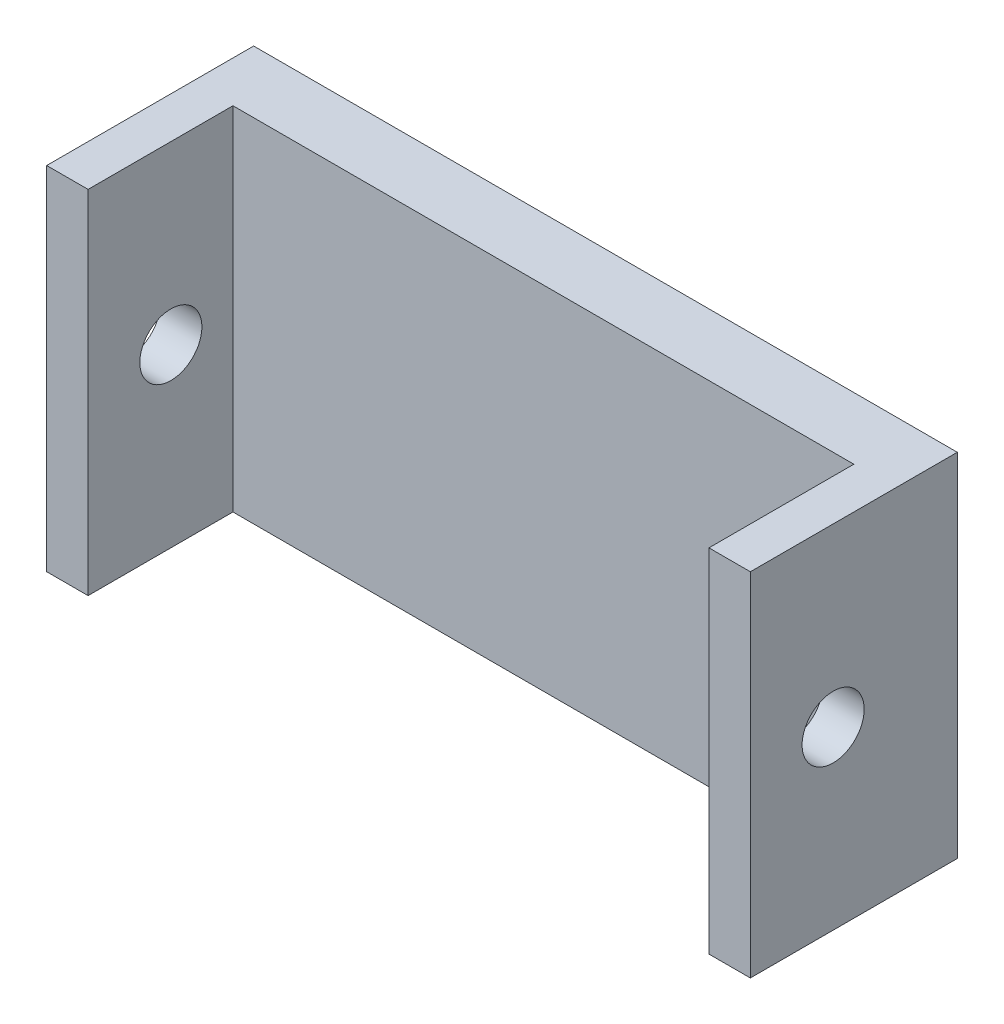
from build123d import *

# Parameters (mm, degrees)
ESQUISSE1_W                  = 30
ESQUISSE1_H                  = 17
BOSS_EXTRU_1_DEPTH           = 3
ESQUISSE2_W                  = 2
ESQUISSE2_H                  = 17
BOSS_EXTRU_2_DEPTH           = 10
ENL_V_MAT_EXTRU_1_DEPTH      = 22.476731595
ENL_V_MAT_EXTRU_1_DEPTH_BACK = 22.476731595
ESQUISSE3_R                  = 1.5
ESQUISSE4_W                  = 1.346153846
ESQUISSE4_H                  = 0.358974359
ENL_V_MAT_EXTRU_2_DEPTH      = 1


with BuildPart() as part:
    # Esquisse1 → Boss.-Extru.1 (new body)
    with BuildSketch(Plane.XY):
        Rectangle(ESQUISSE1_W, ESQUISSE1_H)
    extrude(amount=BOSS_EXTRU_1_DEPTH)

    # Esquisse2 → Boss.-Extru.2 (add)
    with BuildSketch(Plane.XY):
        with Locations((-16, 0)):
            Rectangle(ESQUISSE2_W, ESQUISSE2_H)
        with Locations((16, 0)):
            Rectangle(ESQUISSE2_W, ESQUISSE2_H)
    extrude(amount=BOSS_EXTRU_2_DEPTH)

    # Esquisse3 → Enlèv. mat.-Extru.1 (cut, two sides: drawn at the far end of the back side and taken through both)
    with BuildSketch(Plane(origin=(0, 0, 0), x_dir=(0, 0, -1), z_dir=(1, 0, 0)).offset(-ENL_V_MAT_EXTRU_1_DEPTH_BACK)):
        with Locations((-6, 0)):
            Circle(ESQUISSE3_R)
    extrude(amount=ENL_V_MAT_EXTRU_1_DEPTH + ENL_V_MAT_EXTRU_1_DEPTH_BACK, mode=Mode.SUBTRACT)

    # Esquisse4 → Enlèv. mat.-Extru.2 (cut)
    # profile 1 of 10: a face of its own
    with BuildSketch(Plane(origin=(0, 0, 0), x_dir=(-1, 0, 0), z_dir=(0, 0, -1))):
        Polygon((-15.930769231, -1.5), (-15.468729968, 2), (-15.423858173, 2), (-13.978846154, -0.871794872), (-12.537339744, 2), (-12.491766827, 2), (-12.026923077, -1.5), (-12.342427885, -1.5), (-12.677564103, 1.018429487), (-13.940985577, -1.5), (-14.011798878, -1.5), (-15.280128205, 1.024038462), (-15.614563301, -1.5), align=None)
    # profile 2 of 10: a face of its own
    with BuildSketch(Plane(origin=(0, 0, 0), x_dir=(-1, 0, 0), z_dir=(0, 0, -1))):
        with BuildLine():
            Line((-8.391606571, -1.110176282), (-7.853846154, -1.769230769))
            Line((-7.853846154, -1.769230769), (-8.245773237, -1.769230769))
            Line((-8.245773237, -1.769230769), (-8.634194712, -1.293870192))
            add(Edge.make_bspline(
                [(-8.634194712, -1.293870192), (-8.673151804, -1.317543928), (-8.750348369, -1.36445531), (-8.870715006, -1.424921477), (-8.993475307, -1.475237214), (-9.11835765, -1.516807188), (-9.245180138, -1.550081514), (-9.374585876, -1.573175303), (-9.50610552, -1.586585579), (-9.594467922, -1.588686907), (-9.638902244, -1.58974359)],
                knots=[0, 0, 0, 0, 1.030216282, 2.041455142, 3.041201647, 4.026904037, 5.014869161, 6.002481075, 6.995518502, 8, 8, 8, 8], degree=3))
            add(Edge.make_bspline(
                [(-9.638902244, -1.58974359), (-9.702562584, -1.588210243), (-9.827827184, -1.585193074), (-10.011797302, -1.558852617), (-10.188380921, -1.518172098), (-10.357226071, -1.459311433), (-10.518516683, -1.384128951), (-10.672177821, -1.291439675), (-10.818287587, -1.18252746), (-10.954689177, -1.058104081), (-11.079414594, -0.922748775), (-11.188853333, -0.778127736), (-11.281905829, -0.626640777), (-11.357144316, -0.467532479), (-11.41685611, -0.302187991), (-11.457548079, -0.129232197), (-11.483887517, 0.050305324), (-11.486921884, 0.172548495), (-11.488461538, 0.234575321)],
                knots=[0, 0, 0, 0, 1.055750571, 2.07740284, 3.077223765, 4.05828044, 5.038417088, 6.02463293, 7.030503776, 8.057169806, 9.083586829, 10.080154041, 11.061747002, 12.027853603, 12.995569715, 13.972756451, 14.971366004, 16, 16, 16, 16], degree=3))
            add(Edge.make_bspline(
                [(-11.488461538, 0.234575321), (-11.487913746, 0.276206604), (-11.48682201, 0.359176676), (-11.474192858, 0.482063848), (-11.455429067, 0.602927979), (-11.428888414, 0.721266806), (-11.394144485, 0.837565384), (-11.352490102, 0.951594388), (-11.302020272, 1.063059997), (-11.244965353, 1.171734074), (-11.181332753, 1.276674735), (-11.112016318, 1.376388394), (-11.036845522, 1.469892367), (-10.955873581, 1.557143872), (-10.869423872, 1.638335781), (-10.778239792, 1.714805079), (-10.680377116, 1.783707029), (-10.578418741, 1.847783078), (-10.471792896, 1.90412909), (-10.362585182, 1.954500625), (-10.249978664, 1.995370778), (-10.135434422, 2.0301971), (-10.018257528, 2.056785009), (-9.898539305, 2.075411248), (-9.776363975, 2.088162215), (-9.693856335, 2.089213247), (-9.652223558, 2.08974359)],
                knots=[0, 0, 0, 0, 1.030721839, 2.054201982, 3.056261636, 4.058906239, 5.055198403, 6.060579377, 7.06322398, 8.083343201, 9.098870418, 10.10084648, 11.0888991, 12.067804703, 13.046436456, 14.024708667, 15.012489976, 16.008294399, 17.005242112, 17.997338632, 18.984424362, 19.969624474, 20.960977749, 21.957320355, 22.969278161, 24, 24, 24, 24], degree=3))
            add(Edge.make_bspline(
                [(-9.652223558, 2.08974359), (-9.588562979, 2.088217942), (-9.463529529, 2.085221471), (-9.280015166, 2.058877042), (-9.103951755, 2.018033279), (-8.93546463, 1.959472583), (-8.774704013, 1.884100764), (-8.621737441, 1.791430171), (-8.476327758, 1.682510741), (-8.34063891, 1.55807903), (-8.216207245, 1.422390189), (-8.107287643, 1.276980525), (-8.014617675, 1.124013871), (-7.939243543, 0.96325356), (-7.88069155, 0.794765284), (-7.839762124, 0.618480461), (-7.813543485, 0.434713542), (-7.810513976, 0.309452037), (-7.808974359, 0.245793269)],
                knots=[0, 0, 0, 0, 1.050672203, 2.063587442, 3.054842799, 4.031180399, 5.003107577, 5.981273811, 6.979214548, 7.998088659, 9.016962771, 10.014903508, 10.993069742, 11.96499692, 12.941334519, 13.932589877, 14.949327797, 16, 16, 16, 16], degree=3))
            add(Edge.make_bspline(
                [(-7.808974359, 0.245793269), (-7.810656977, 0.179555903), (-7.81396575, 0.049303873), (-7.842123978, -0.141696853), (-7.887397465, -0.32414754), (-7.951600737, -0.497928645), (-8.034601058, -0.663008582), (-8.134794925, -0.821038167), (-8.25338868, -0.972006194), (-8.345048735, -1.063634549), (-8.391606571, -1.110176282)],
                knots=[0, 0, 0, 0, 1.045660934, 2.056233022, 3.041853582, 4.009978652, 4.97562384, 5.954545411, 6.961031197, 8, 8, 8, 8], degree=3))
        make_face()
        with BuildLine():
            add(Edge.make_bspline(
                [(-8.602644231, -0.85146234), (-8.56445555, -0.812679367), (-8.489336721, -0.736391539), (-8.391871519, -0.611283538), (-8.308041666, -0.481236306), (-8.240926744, -0.344519906), (-8.187527672, -0.202847193), (-8.150634779, -0.055095609), (-8.127534697, 0.098062214), (-8.124573773, 0.202241569), (-8.123076923, 0.254907853)],
                knots=[0, 0, 0, 0, 1.052210109, 2.069743939, 3.061837814, 4.040478349, 5.010453814, 5.985306305, 6.981502329, 8, 8, 8, 8], degree=3))
            add(Edge.make_bspline(
                [(-8.123076923, 0.254907853), (-8.123468028, 0.288824285), (-8.124241172, 0.355871096), (-8.134871897, 0.455088613), (-8.14991121, 0.552114782), (-8.171683525, 0.646776244), (-8.199720918, 0.738881211), (-8.234349562, 0.828304648), (-8.274894771, 0.915335043), (-8.322161625, 0.999431767), (-8.374269333, 1.080472932), (-8.432271604, 1.157467442), (-8.495352024, 1.230018293), (-8.562821468, 1.299321088), (-8.635980745, 1.363947241), (-8.71456748, 1.42386905), (-8.797613306, 1.480536605), (-8.885529168, 1.531686389), (-8.976126438, 1.578710633), (-9.068874995, 1.619430719), (-9.16299606, 1.653919173), (-9.258343881, 1.681884879), (-9.354795076, 1.703897452), (-9.452518745, 1.718919937), (-9.551262173, 1.729539715), (-9.617606643, 1.730359043), (-9.650821314, 1.730769231)],
                knots=[0, 0, 0, 0, 1.032958288, 2.041976502, 3.037103433, 4.023477888, 4.998866292, 5.968231228, 6.943073582, 7.921783703, 8.90545537, 9.876780072, 10.85618943, 11.833110341, 12.821898168, 13.827467856, 14.842673888, 15.88323808, 16.924703457, 17.951432745, 18.967462636, 19.976958182, 20.977218729, 21.979378626, 22.98839684, 24, 24, 24, 24], degree=3))
            add(Edge.make_bspline(
                [(-9.650821314, 1.730769231), (-9.684269076, 1.73035618), (-9.751078683, 1.729531141), (-9.850298829, 1.718978673), (-9.948246774, 1.703880915), (-10.044491723, 1.681977747), (-10.139374515, 1.653957655), (-10.23260064, 1.619260699), (-10.324980841, 1.579546383), (-10.414598143, 1.532552164), (-10.501295748, 1.480962541), (-10.583750656, 1.424858446), (-10.660832881, 1.363680126), (-10.733273623, 1.298412547), (-10.800891948, 1.22855212), (-10.864007118, 1.154563553), (-10.921510718, 1.075588353), (-10.974194832, 0.993039511), (-11.020759552, 0.906827339), (-11.062755021, 0.818507309), (-11.09686467, 0.727105705), (-11.124867968, 0.633354104), (-11.147750902, 0.537485578), (-11.162499841, 0.438943614), (-11.173210307, 0.338343373), (-11.173973137, 0.270362218), (-11.174358974, 0.235977564)],
                knots=[0, 0, 0, 0, 1.013205451, 2.023808328, 3.020541854, 4.015386314, 5.012622987, 6.016502547, 7.02834558, 8.057881235, 9.080621846, 10.084476421, 11.077781791, 12.060654405, 13.037357686, 14.022218736, 15.005346502, 15.995617173, 16.98763393, 17.973029642, 18.956998942, 19.940662314, 20.93709383, 21.940823471, 22.958474994, 24, 24, 24, 24], degree=3))
            add(Edge.make_bspline(
                [(-11.174358974, 0.235977564), (-11.173045418, 0.185424653), (-11.170461246, 0.085971437), (-11.149039102, -0.060043048), (-11.11312219, -0.199829538), (-11.062872938, -0.333588015), (-10.999791895, -0.462089437), (-10.921345848, -0.58407492), (-10.82786947, -0.699079838), (-10.722899013, -0.807894117), (-10.607429943, -0.906475497), (-10.48502153, -0.993237875), (-10.356718868, -1.066848065), (-10.222119064, -1.126260077), (-10.082225835, -1.173969933), (-9.935934866, -1.206270459), (-9.784202467, -1.227680115), (-9.680811058, -1.229729878), (-9.628385417, -1.230769231)],
                knots=[0, 0, 0, 0, 1.022526523, 2.011626, 2.97850031, 3.937665323, 4.897797383, 5.869804095, 6.865337375, 7.89202157, 8.925035373, 9.93268082, 10.923937058, 11.912550332, 12.905497077, 13.90928476, 14.939882052, 16, 16, 16, 16], degree=3))
            add(Edge.make_bspline(
                [(-9.628385417, -1.230769231), (-9.592367013, -1.23037686), (-9.521125153, -1.229600778), (-9.416071148, -1.21902016), (-9.313587923, -1.204127721), (-9.214624497, -1.181477781), (-9.118322706, -1.153318923), (-9.025255766, -1.119066215), (-8.934929993, -1.078459342), (-8.877496924, -1.046334526), (-8.848737981, -1.030248397)],
                knots=[0, 0, 0, 0, 1.060694673, 2.097979151, 3.107774411, 4.11000626, 5.086069662, 6.061987343, 7.029562652, 8, 8, 8, 8], degree=3))
            Line((-8.848737981, -1.030248397), (-9.636798878, -0.064102564))
            Line((-9.636798878, -0.064102564), (-9.244871795, -0.064102564))
            Line((-9.244871795, -0.064102564), (-8.602644231, -0.85146234))
        make_face(mode=Mode.SUBTRACT)
    # profile 3 of 10: a face of its own
    with BuildSketch(Plane(origin=(0, 0, 0), x_dir=(-1, 0, 0), z_dir=(0, 0, -1))):
        with Locations((-6.732051282, -0.153846153)):
            Rectangle(ESQUISSE4_W, ESQUISSE4_H)
    # profile 4 of 10: a face of its own
    with BuildSketch(Plane(origin=(0, 0, 0), x_dir=(-1, 0, 0), z_dir=(0, 0, -1))):
        with BuildLine():
            Line((-5.341025641, 1.192307692), (-5.655128205, 1.192307692))
            add(Edge.make_bspline(
                [(-5.655128205, 1.192307692), (-5.646618654, 1.227540176), (-5.629983179, 1.296416801), (-5.595285605, 1.394824062), (-5.55748635, 1.487947583), (-5.512097246, 1.574043657), (-5.462588491, 1.654842559), (-5.40586577, 1.728511684), (-5.344546047, 1.796924649), (-5.276721098, 1.857637887), (-5.205592436, 1.912615616), (-5.130157817, 1.959490673), (-5.051934923, 1.999814826), (-4.97038179, 2.033035058), (-4.885255618, 2.058060582), (-4.797325995, 2.076217387), (-4.706362495, 2.088008502), (-4.644614904, 2.089159265), (-4.613261218, 2.08974359)],
                knots=[0, 0, 0, 0, 1.162005537, 2.271625781, 3.343758855, 4.383309926, 5.390229558, 6.379919256, 7.361854164, 8.333198761, 9.295911338, 10.242430842, 11.177959212, 12.116337295, 13.062827104, 14.020064771, 14.994644689, 16, 16, 16, 16], degree=3))
            add(Edge.make_bspline(
                [(-4.613261218, 2.08974359), (-4.567578476, 2.088364359), (-4.477209465, 2.085635984), (-4.344446418, 2.060721548), (-4.216419599, 2.021296415), (-4.094530351, 1.966822688), (-3.981311918, 1.899635375), (-3.880575732, 1.819670638), (-3.793687221, 1.728471337), (-3.720792843, 1.627738772), (-3.663717844, 1.520083263), (-3.621631471, 1.409283106), (-3.59600979, 1.295601134), (-3.592689233, 1.218843855), (-3.591025641, 1.180388622)],
                knots=[0, 0, 0, 0, 1.083050992, 2.142477498, 3.193116406, 4.255571735, 5.30263384, 6.308962982, 7.297363603, 8.282367274, 9.249857812, 10.179914175, 11.08814088, 12, 12, 12, 12], degree=3))
            add(Edge.make_bspline(
                [(-3.591025641, 1.180388622), (-3.592189232, 1.143381827), (-3.594466199, 1.070965273), (-3.613799905, 0.965243775), (-3.646336168, 0.865602175), (-3.69140593, 0.771621013), (-3.74974748, 0.683896173), (-3.820420177, 0.602230282), (-3.903922839, 0.526261124), (-3.967201777, 0.482741651), (-3.999779647, 0.460336538)],
                knots=[0, 0, 0, 0, 1.024540389, 2.004866551, 2.965041327, 3.920577974, 4.882998113, 5.874504559, 6.905732034, 8, 8, 8, 8], degree=3))
            add(Edge.make_bspline(
                [(-3.999779647, 0.460336538), (-3.962547893, 0.442358367), (-3.888781019, 0.406738409), (-3.788230489, 0.336882652), (-3.696952614, 0.256226304), (-3.646048895, 0.193283652), (-3.620472756, 0.161658654)],
                knots=[0, 0, 0, 0, 1.015518401, 2.012035669, 3.001164323, 4, 4, 4, 4], degree=3))
            add(Edge.make_bspline(
                [(-3.620472756, 0.161658654), (-3.603631414, 0.138600902), (-3.570224518, 0.092862986), (-3.528988984, 0.01932656), (-3.49157987, -0.055024929), (-3.462429651, -0.132184336), (-3.439855784, -0.211257349), (-3.423719752, -0.292379745), (-3.413695611, -0.375617768), (-3.412260059, -0.431930248), (-3.411538462, -0.460236378)],
                knots=[0, 0, 0, 0, 1.025084078, 2.033381695, 3.024893161, 4.013698104, 4.991890475, 5.976764909, 6.982997093, 8, 8, 8, 8], degree=3))
            add(Edge.make_bspline(
                [(-3.411538462, -0.460236378), (-3.413332975, -0.509246099), (-3.416913557, -0.607034901), (-3.448917631, -0.751509623), (-3.498530872, -0.892735125), (-3.568987808, -1.027809964), (-3.654855317, -1.154190345), (-3.757012641, -1.267266654), (-3.874299049, -1.364465259), (-4.005104698, -1.445675487), (-4.146821827, -1.510593409), (-4.298397419, -1.555650852), (-4.457647473, -1.584996852), (-4.56685477, -1.58814372), (-4.622375801, -1.58974359)],
                knots=[0, 0, 0, 0, 0.955779014, 1.907060117, 2.875433937, 3.871313158, 4.872415639, 5.851225146, 6.836215519, 7.83643374, 8.849228613, 9.86973379, 10.916971861, 12, 12, 12, 12], degree=3))
            add(Edge.make_bspline(
                [(-4.622375801, -1.58974359), (-4.659795102, -1.588875376), (-4.733423807, -1.587167022), (-4.841667305, -1.575488421), (-4.944989004, -1.554158416), (-5.043528602, -1.525455111), (-5.137373639, -1.489063368), (-5.226237744, -1.44374467), (-5.310667637, -1.390433168), (-5.389866588, -1.328499581), (-5.463825156, -1.259218241), (-5.53057788, -1.181359231), (-5.591237673, -1.096361827), (-5.644180312, -1.003238771), (-5.691817265, -0.903193513), (-5.730998221, -0.794945015), (-5.76548379, -0.679460993), (-5.781517254, -0.598983253), (-5.78974359, -0.557692308)],
                knots=[0, 0, 0, 0, 1.048658725, 2.063410685, 3.046034179, 4.001477787, 4.936774919, 5.862367409, 6.792675028, 7.730719943, 8.675894397, 9.627829632, 10.600096036, 11.597688215, 12.626045268, 13.701542398, 14.82072376, 16, 16, 16, 16], degree=3))
            Line((-5.78974359, -0.557692308), (-5.475641026, -0.557692308))
            add(Edge.make_bspline(
                [(-5.475641026, -0.557692308), (-5.467457734, -0.584641321), (-5.451540522, -0.637059493), (-5.424446224, -0.712499798), (-5.393577951, -0.781657851), (-5.360463393, -0.845040973), (-5.325684947, -0.903273376), (-5.286770022, -0.954815245), (-5.246600876, -1.001930447), (-5.216321523, -1.028475059), (-5.201502404, -1.041466346)],
                knots=[0, 0, 0, 0, 1.198163088, 2.33053128, 3.407730985, 4.417276592, 5.372219308, 6.28897303, 7.162600585, 8, 8, 8, 8], degree=3))
            add(Edge.make_bspline(
                [(-5.201502404, -1.041466346), (-5.181905827, -1.05657468), (-5.142773164, -1.086744712), (-5.079004933, -1.12524634), (-5.011940047, -1.158607366), (-4.940125373, -1.184091061), (-4.865110603, -1.205668722), (-4.785683237, -1.219789241), (-4.70254402, -1.229477413), (-4.645776257, -1.230332344), (-4.616766827, -1.230769231)],
                knots=[0, 0, 0, 0, 0.946170439, 1.889420265, 2.845303464, 3.807233317, 4.801018734, 5.828864929, 6.890507805, 8, 8, 8, 8], degree=3))
            add(Edge.make_bspline(
                [(-4.616766827, -1.230769231), (-4.584013324, -1.230153326), (-4.519966677, -1.228948976), (-4.426511818, -1.217873269), (-4.33760437, -1.201742856), (-4.254231445, -1.176829873), (-4.175300937, -1.146049021), (-4.101919288, -1.107400616), (-4.033123182, -1.062055894), (-3.969793776, -1.010516736), (-3.912848269, -0.954095241), (-3.862708755, -0.89508217), (-3.820084094, -0.83372634), (-3.785700516, -0.769688219), (-3.758549965, -0.70323299), (-3.740066765, -0.634174161), (-3.72721525, -0.563076895), (-3.726168638, -0.514747926), (-3.725641026, -0.490384615)],
                knots=[0, 0, 0, 0, 1.217147791, 2.380027433, 3.494444702, 4.572153297, 5.609568379, 6.639424714, 7.649109417, 8.668170816, 9.669597737, 10.625200337, 11.543417969, 12.441394052, 13.322311151, 14.205496177, 15.095365482, 16, 16, 16, 16], degree=3))
            add(Edge.make_bspline(
                [(-3.725641026, -0.490384615), (-3.727171327, -0.457773277), (-3.730224316, -0.392712868), (-3.753532895, -0.296995294), (-3.791871759, -0.204771882), (-3.845544271, -0.117616091), (-3.910879999, -0.03684019), (-3.987244906, 0.035231293), (-4.075273134, 0.094701384), (-4.156293004, 0.13579004), (-4.22805816, 0.163827115), (-4.289473544, 0.18250208), (-4.358230148, 0.198315735), (-4.433496497, 0.213028007), (-4.515839713, 0.225549355), (-4.605170151, 0.235991171), (-4.701505913, 0.244346212), (-4.768197079, 0.248077307), (-4.802564103, 0.25)],
                knots=[0, 0, 0, 0, 1.07054697, 2.135767047, 3.216561865, 4.33974944, 5.486079747, 6.621378074, 7.775625952, 8.963672916, 9.598146892, 10.304877434, 11.070270905, 11.915000392, 12.823868403, 13.805723172, 14.86925407, 16, 16, 16, 16], degree=3))
            Line((-4.802564103, 0.25), (-4.802564103, 0.608974359))
            add(Edge.make_bspline(
                [(-4.802564103, 0.608974359), (-4.759262937, 0.609709163), (-4.67444659, 0.611148463), (-4.550552286, 0.628556473), (-4.432078973, 0.652637101), (-4.321652231, 0.689522293), (-4.221003518, 0.73236259), (-4.133683916, 0.7822148), (-4.060916769, 0.837629549), (-4.003055697, 0.899462158), (-3.959526469, 0.965777206), (-3.927699671, 1.034893864), (-3.908899345, 1.107417924), (-3.906389678, 1.156912592), (-3.905128205, 1.181790865)],
                knots=[0, 0, 0, 0, 1.321986639, 2.589447074, 3.816329219, 5.01088745, 6.139805852, 7.153945165, 8.075214402, 8.924034688, 9.728124013, 10.488707548, 11.240355623, 12, 12, 12, 12], degree=3))
            add(Edge.make_bspline(
                [(-3.905128205, 1.181790865), (-3.905542616, 1.200068611), (-3.906367067, 1.236431318), (-3.916764345, 1.289556386), (-3.932388386, 1.341057332), (-3.953868115, 1.390715142), (-3.982618314, 1.438185416), (-4.0170243, 1.483872865), (-4.057992401, 1.527516644), (-4.104937848, 1.568196964), (-4.155349653, 1.606966201), (-4.210599428, 1.639879838), (-4.269021302, 1.6680249), (-4.330679957, 1.691234402), (-4.395775488, 1.70869369), (-4.464002045, 1.721229532), (-4.535489729, 1.729067187), (-4.584261461, 1.730195602), (-4.609054487, 1.730769231)],
                knots=[0, 0, 0, 0, 0.884392785, 1.759457502, 2.611959086, 3.489218968, 4.37281399, 5.2945488, 6.255912374, 7.266815255, 8.301784654, 9.332968512, 10.37626691, 11.440494194, 12.520033166, 13.637162961, 14.798855837, 16, 16, 16, 16], degree=3))
            add(Edge.make_bspline(
                [(-4.609054487, 1.730769231), (-4.648906155, 1.729377869), (-4.726745732, 1.726660215), (-4.838960648, 1.702857202), (-4.943279982, 1.664879118), (-5.023018649, 1.619546099), (-5.081901223, 1.574795665), (-5.123978161, 1.535713279), (-5.165298672, 1.492280455), (-5.203144349, 1.44182208), (-5.241418325, 1.387755289), (-5.276262887, 1.327331608), (-5.310122579, 1.262127214), (-5.330525129, 1.216031579), (-5.341025641, 1.192307692)],
                knots=[0, 0, 0, 0, 1.472543308, 2.876219568, 4.221790263, 5.565193594, 6.249813518, 6.953379497, 7.687249741, 8.463570142, 9.283606569, 10.136032583, 11.040678096, 12, 12, 12, 12], degree=3))
        make_face()
    # profile 5 of 10: a face of its own
    with BuildSketch(Plane(origin=(0, 0, 0), x_dir=(-1, 0, 0), z_dir=(0, 0, -1))):
        with BuildLine():
            Line((-1.796153846, -0.824819712), (-1.500280449, -0.647435897))
            add(Edge.make_bspline(
                [(-1.500280449, -0.647435897), (-1.472762211, -0.693500282), (-1.420038331, -0.781757866), (-1.332086972, -0.901015907), (-1.240954061, -1.002378063), (-1.145964727, -1.085254671), (-1.047698779, -1.150503558), (-0.945514725, -1.196705789), (-0.839756914, -1.225521765), (-0.767783093, -1.229021851), (-0.731850962, -1.230769231)],
                knots=[0, 0, 0, 0, 1.272034388, 2.437168799, 3.508375237, 4.49857839, 5.41946034, 6.295179144, 7.148887113, 8, 8, 8, 8], degree=3))
            add(Edge.make_bspline(
                [(-0.731850962, -1.230769231), (-0.701164101, -1.229914558), (-0.640327328, -1.228220168), (-0.550765085, -1.211939366), (-0.463783283, -1.186927237), (-0.381174645, -1.151106306), (-0.30407903, -1.10776782), (-0.236472335, -1.055421642), (-0.178026222, -0.996815437), (-0.130217107, -0.931432782), (-0.093537072, -0.861115633), (-0.065345004, -0.788939682), (-0.04969993, -0.713771114), (-0.047343177, -0.663160651), (-0.046153846, -0.637620192)],
                knots=[0, 0, 0, 0, 1.095163259, 2.171163733, 3.241058638, 4.321873601, 5.38011039, 6.391990106, 7.366004449, 8.327778327, 9.272591725, 10.192022065, 11.087607919, 12, 12, 12, 12], degree=3))
            add(Edge.make_bspline(
                [(-0.046153846, -0.637620192), (-0.047628157, -0.608479343), (-0.050625215, -0.549240253), (-0.075956695, -0.4618406), (-0.115805942, -0.37534803), (-0.152568586, -0.321846765), (-0.171654647, -0.294070513)],
                knots=[0, 0, 0, 0, 0.938893495, 1.908633276, 2.914225137, 4, 4, 4, 4], degree=3))
            add(Edge.make_bspline(
                [(-0.171654647, -0.294070513), (-0.187325262, -0.274023689), (-0.220223756, -0.231937891), (-0.276781268, -0.169292655), (-0.343147383, -0.104674236), (-0.417050938, -0.035615179), (-0.501184027, 0.034672617), (-0.592911541, 0.109540895), (-0.6945754, 0.186142472), (-0.765874897, 0.237515038), (-0.802664263, 0.264022436)],
                knots=[0, 0, 0, 0, 0.722233717, 1.516239348, 2.393582979, 3.351407094, 4.387010283, 5.505090956, 6.712668013, 8, 8, 8, 8], degree=3))
            add(Edge.make_bspline(
                [(-0.802664263, 0.264022436), (-0.839488259, 0.290251024), (-0.909892936, 0.340398086), (-1.008351518, 0.41482237), (-1.096395981, 0.482866239), (-1.173634997, 0.545170251), (-1.240034594, 0.601742856), (-1.296118005, 0.652040795), (-1.340456562, 0.697424356), (-1.365112143, 0.726865698), (-1.376181891, 0.740084135)],
                knots=[0, 0, 0, 0, 1.452282411, 2.77665338, 3.964542531, 5.026858415, 5.96415736, 6.766646006, 7.446254459, 8, 8, 8, 8], degree=3))
            add(Edge.make_bspline(
                [(-1.376181891, 0.740084135), (-1.391654436, 0.760685171), (-1.422083273, 0.801199875), (-1.462249278, 0.864524733), (-1.496388441, 0.929347998), (-1.523150773, 0.995843863), (-1.545686992, 1.063078792), (-1.560844923, 1.131930038), (-1.57033632, 1.202088656), (-1.571308306, 1.249302157), (-1.571794872, 1.272936699)],
                knots=[0, 0, 0, 0, 1.068054152, 2.10047183, 3.106115577, 4.101338837, 5.06977816, 6.043150881, 7.020423561, 8, 8, 8, 8], degree=3))
            add(Edge.make_bspline(
                [(-1.571794872, 1.272936699), (-1.570489663, 1.309966473), (-1.567907143, 1.383234537), (-1.546066625, 1.490265367), (-1.511593732, 1.592451785), (-1.463298844, 1.688782118), (-1.401041491, 1.776748099), (-1.328995517, 1.857361586), (-1.24318403, 1.925130168), (-1.149031407, 1.984342227), (-1.045975035, 2.030688152), (-0.937984132, 2.065649132), (-0.82488706, 2.08545839), (-0.748283925, 2.088301155), (-0.709415064, 2.08974359)],
                knots=[0, 0, 0, 0, 1.005424448, 1.989358655, 2.955360095, 3.929531133, 4.905563448, 5.876582895, 6.856512386, 7.866279853, 8.892233794, 9.918561126, 10.94386622, 12, 12, 12, 12], degree=3))
            add(Edge.make_bspline(
                [(-0.709415064, 2.08974359), (-0.668170964, 2.088321038), (-0.586149612, 2.085492037), (-0.465500396, 2.060894506), (-0.34933968, 2.020193834), (-0.255896415, 1.974005176), (-0.182763654, 1.92787376), (-0.126990921, 1.885853936), (-0.07047347, 1.837478827), (-0.012755416, 1.782619581), (0.045185244, 1.72077283), (0.104208696, 1.652362141), (0.164452965, 1.577805585), (0.203208825, 1.524581085), (0.223076923, 1.497295673)],
                knots=[0, 0, 0, 0, 1.286793592, 2.559021753, 3.825965368, 5.121522368, 5.803751409, 6.523245864, 7.299691795, 8.125521123, 9.008227632, 9.944561021, 10.946284179, 12, 12, 12, 12], degree=3))
            Line((0.223076923, 1.497295673), (-0.060877404, 1.282051282))
            add(Edge.make_bspline(
                [(-0.060877404, 1.282051282), (-0.078023336, 1.304139972), (-0.111042393, 1.346677626), (-0.16117188, 1.406248941), (-0.208420528, 1.460665421), (-0.254970928, 1.507930549), (-0.298364559, 1.550632682), (-0.340481602, 1.587192439), (-0.380715953, 1.617968034), (-0.431432864, 1.650811594), (-0.495150582, 1.683368098), (-0.575135118, 1.710917176), (-0.658721393, 1.727472238), (-0.715651025, 1.729661126), (-0.744471154, 1.730769231)],
                knots=[0, 0, 0, 0, 1.181633172, 2.275549214, 3.290209073, 4.226197932, 5.078386478, 5.862611352, 6.581680152, 7.217281963, 8.414376989, 9.595101626, 10.782541182, 12, 12, 12, 12], degree=3))
            add(Edge.make_bspline(
                [(-0.744471154, 1.730769231), (-0.780627676, 1.729557531), (-0.850352124, 1.727220882), (-0.94934236, 1.701700896), (-1.038436285, 1.661519036), (-1.11498885, 1.605204058), (-1.178725827, 1.538483065), (-1.224831286, 1.46170421), (-1.25258145, 1.376921808), (-1.25596773, 1.317780151), (-1.257692308, 1.287660256)],
                knots=[0, 0, 0, 0, 1.14458467, 2.207223713, 3.21896685, 4.227309161, 5.202851033, 6.127160689, 7.046193047, 8, 8, 8, 8], degree=3))
            add(Edge.make_bspline(
                [(-1.257692308, 1.287660256), (-1.257299181, 1.268908778), (-1.256512285, 1.231375158), (-1.245537487, 1.175923736), (-1.231438158, 1.120612397), (-1.209095527, 1.065689814), (-1.178250223, 1.010195455), (-1.137745047, 0.953173718), (-1.086731735, 0.894122009), (-1.047654723, 0.855714635), (-1.027023237, 0.835436699)],
                knots=[0, 0, 0, 0, 0.858281714, 1.717966888, 2.583508476, 3.4729293, 4.427298488, 5.488583878, 6.674047936, 8, 8, 8, 8], degree=3))
            add(Edge.make_bspline(
                [(-1.027023237, 0.835436699), (-1.019361865, 0.828599673), (-1.001160198, 0.812356465), (-0.967884272, 0.785764184), (-0.923941474, 0.752961412), (-0.870479272, 0.712374095), (-0.806511911, 0.665292633), (-0.732032355, 0.612319021), (-0.647870822, 0.551733562), (-0.588148906, 0.509376021), (-0.556570513, 0.486979167)],
                knots=[0, 0, 0, 0, 0.420754252, 0.999615792, 1.744751191, 2.668019286, 3.750313428, 4.999500688, 6.413464383, 8, 8, 8, 8], degree=3))
            add(Edge.make_bspline(
                [(-0.556570513, 0.486979167), (-0.5185846, 0.459337807), (-0.445030143, 0.405814145), (-0.340372563, 0.325398465), (-0.245478755, 0.246750697), (-0.160015552, 0.17037309), (-0.083138643, 0.096844997), (-0.015700922, 0.025281816), (0.042984758, -0.043803756), (0.106163976, -0.132376332), (0.170721796, -0.241157416), (0.226163303, -0.374435655), (0.261121651, -0.508231975), (0.265693166, -0.598158812), (0.267948718, -0.642528045)],
                knots=[0, 0, 0, 0, 1.163667725, 2.253281268, 3.268753668, 4.215851969, 5.092017293, 5.902905408, 6.650798638, 7.335211899, 8.59617414, 9.77448103, 10.901945474, 12, 12, 12, 12], degree=3))
            add(Edge.make_bspline(
                [(0.267948718, -0.642528045), (0.26729158, -0.67390641), (0.265990065, -0.736053794), (0.251029151, -0.82730887), (0.229109486, -0.91593974), (0.196072252, -1.000850853), (0.155749094, -1.083595615), (0.104582846, -1.162003516), (0.045275161, -1.237809914), (-0.022758604, -1.308993406), (-0.097204506, -1.374339602), (-0.175888201, -1.432468663), (-0.258938474, -1.480936986), (-0.345904791, -1.520487828), (-0.436807127, -1.551421346), (-0.531614911, -1.573834215), (-0.630484422, -1.587589926), (-0.697684904, -1.589017687), (-0.731850962, -1.58974359)],
                knots=[0, 0, 0, 0, 0.983748083, 1.948392443, 2.894712957, 3.844097841, 4.80183111, 5.778335162, 6.776009319, 7.81870978, 8.863265674, 9.881300176, 10.883814829, 11.87499822, 12.874611388, 13.892143829, 14.928324115, 16, 16, 16, 16], degree=3))
            add(Edge.make_bspline(
                [(-0.731850962, -1.58974359), (-0.758286305, -1.589232408), (-0.810824065, -1.588216483), (-0.888533546, -1.579235202), (-0.964673136, -1.566528099), (-1.038287418, -1.546354029), (-1.110324829, -1.521877052), (-1.180472064, -1.491738719), (-1.248763118, -1.455621518), (-1.315580701, -1.414326493), (-1.380754875, -1.366268748), (-1.443674343, -1.310295252), (-1.506403529, -1.247949747), (-1.567090925, -1.177539184), (-1.626964069, -1.100201101), (-1.684842479, -1.015211917), (-1.741924196, -0.923034564), (-1.777739664, -0.858169478), (-1.796153846, -0.824819712)],
                knots=[0, 0, 0, 0, 0.915332311, 1.819136955, 2.706846663, 3.586547465, 4.459518054, 5.340707479, 6.227863349, 7.133153174, 8.059268498, 9.028702269, 10.047606654, 11.120612155, 12.245963614, 13.433783089, 14.680604001, 16, 16, 16, 16], degree=3))
        make_face()
    # profile 6 of 10: a face of its own
    with BuildSketch(Plane(origin=(0, 0, 0), x_dir=(-1, 0, 0), z_dir=(0, 0, -1))):
        Polygon((0.985897436, 2), (2.96025641, 2), (2.96025641, 1.641025641), (1.3, 1.641025641), (1.3, 0.564102564), (2.96025641, 0.564102564), (2.96025641, 0.205128205), (1.3, 0.205128205), (1.3, -1.141025641), (2.96025641, -1.141025641), (2.96025641, -1.5), (0.985897436, -1.5), align=None)
    # profile 7 of 10: a face of its own
    with BuildSketch(Plane(origin=(0, 0, 0), x_dir=(-1, 0, 0), z_dir=(0, 0, -1))):
        Polygon((3.588461538, -1.5), (3.588461538, 2), (3.654366987, 2), (5.966666667, -0.754707532), (5.966666667, 2), (6.280769231, 2), (6.280769231, -1.5), (6.209254808, -1.5), (3.902564103, 1.248397436), (3.902564103, -1.5), align=None)
    # profile 8 of 10: a face of its own
    with BuildSketch(Plane(origin=(0, 0, 0), x_dir=(-1, 0, 0), z_dir=(0, 0, -1))):
        with BuildLine():
            Line((6.819230769, -0.824819712), (7.115104167, -0.647435897))
            add(Edge.make_bspline(
                [(7.115104167, -0.647435897), (7.142622404, -0.693500282), (7.195346285, -0.781757866), (7.283297644, -0.901015907), (7.374430555, -1.002378063), (7.469419888, -1.085254671), (7.567685837, -1.150503558), (7.66986989, -1.196705789), (7.775627701, -1.225521765), (7.847601522, -1.229021851), (7.883533654, -1.230769231)],
                knots=[0, 0, 0, 0, 1.272034388, 2.437168799, 3.508375237, 4.49857839, 5.41946034, 6.295179144, 7.148887113, 8, 8, 8, 8], degree=3))
            add(Edge.make_bspline(
                [(7.883533654, -1.230769231), (7.914220514, -1.229914558), (7.975057287, -1.228220168), (8.06461953, -1.211939366), (8.151601333, -1.186927237), (8.23420997, -1.151106306), (8.311305585, -1.10776782), (8.37891228, -1.055421642), (8.437358393, -0.996815437), (8.485167508, -0.931432782), (8.521847543, -0.861115633), (8.550039612, -0.788939682), (8.565684685, -0.713771114), (8.568041439, -0.663160651), (8.569230769, -0.637620192)],
                knots=[0, 0, 0, 0, 1.095163259, 2.171163733, 3.241058638, 4.321873601, 5.38011039, 6.391990106, 7.366004449, 8.327778327, 9.272591725, 10.192022065, 11.087607919, 12, 12, 12, 12], degree=3))
            add(Edge.make_bspline(
                [(8.569230769, -0.637620192), (8.567756459, -0.608479343), (8.5647594, -0.549240253), (8.53942792, -0.4618406), (8.499578673, -0.37534803), (8.46281603, -0.321846765), (8.443729968, -0.294070513)],
                knots=[0, 0, 0, 0, 0.938893495, 1.908633276, 2.914225137, 4, 4, 4, 4], degree=3))
            add(Edge.make_bspline(
                [(8.443729968, -0.294070513), (8.428059354, -0.274023689), (8.395160859, -0.231937891), (8.338603347, -0.169292655), (8.272237233, -0.104674236), (8.198333678, -0.035615179), (8.114200589, 0.034672617), (8.022473074, 0.109540895), (7.920809215, 0.186142472), (7.849509719, 0.237515038), (7.812720353, 0.264022436)],
                knots=[0, 0, 0, 0, 0.722233717, 1.516239348, 2.393582979, 3.351407094, 4.387010283, 5.505090956, 6.712668013, 8, 8, 8, 8], degree=3))
            add(Edge.make_bspline(
                [(7.812720353, 0.264022436), (7.775896356, 0.290251024), (7.70549168, 0.340398086), (7.607033097, 0.41482237), (7.518988634, 0.482866239), (7.441749618, 0.545170251), (7.375350021, 0.601742856), (7.31926661, 0.652040795), (7.274928053, 0.697424356), (7.250272472, 0.726865698), (7.239202724, 0.740084135)],
                knots=[0, 0, 0, 0, 1.452282411, 2.77665338, 3.964542531, 5.026858415, 5.96415736, 6.766646006, 7.446254459, 8, 8, 8, 8], degree=3))
            add(Edge.make_bspline(
                [(7.239202724, 0.740084135), (7.223730179, 0.760685171), (7.193301342, 0.801199875), (7.153135337, 0.864524733), (7.118996174, 0.929347998), (7.092233842, 0.995843863), (7.069697623, 1.063078792), (7.054539692, 1.131930038), (7.045048296, 1.202088656), (7.044076309, 1.249302157), (7.043589744, 1.272936699)],
                knots=[0, 0, 0, 0, 1.068054152, 2.10047183, 3.106115577, 4.101338837, 5.06977816, 6.043150881, 7.020423561, 8, 8, 8, 8], degree=3))
            add(Edge.make_bspline(
                [(7.043589744, 1.272936699), (7.044894953, 1.309966473), (7.047477473, 1.383234537), (7.06931799, 1.490265367), (7.103790884, 1.592451785), (7.152085771, 1.688782118), (7.214343124, 1.776748099), (7.286389099, 1.857361586), (7.372200585, 1.925130168), (7.466353208, 1.984342227), (7.56940958, 2.030688152), (7.677400484, 2.065649132), (7.790497556, 2.08545839), (7.86710069, 2.088301155), (7.905969551, 2.08974359)],
                knots=[0, 0, 0, 0, 1.005424448, 1.989358655, 2.955360095, 3.929531133, 4.905563448, 5.876582895, 6.856512386, 7.866279853, 8.892233794, 9.918561126, 10.94386622, 12, 12, 12, 12], degree=3))
            add(Edge.make_bspline(
                [(7.905969551, 2.08974359), (7.947213652, 2.088321038), (8.029235003, 2.085492037), (8.149884219, 2.060894506), (8.266044935, 2.020193834), (8.3594882, 1.974005176), (8.432620962, 1.92787376), (8.488393694, 1.885853936), (8.544911145, 1.837478827), (8.6026292, 1.782619581), (8.660569859, 1.72077283), (8.719593312, 1.652362141), (8.77983758, 1.577805585), (8.818593441, 1.524581085), (8.838461538, 1.497295673)],
                knots=[0, 0, 0, 0, 1.286793592, 2.559021753, 3.825965368, 5.121522368, 5.803751409, 6.523245864, 7.299691795, 8.125521123, 9.008227632, 9.944561021, 10.946284179, 12, 12, 12, 12], degree=3))
            Line((8.838461538, 1.497295673), (8.554507212, 1.282051282))
            add(Edge.make_bspline(
                [(8.554507212, 1.282051282), (8.537361279, 1.304139972), (8.504342222, 1.346677626), (8.454212735, 1.406248941), (8.406964087, 1.460665421), (8.360413687, 1.507930549), (8.317020056, 1.550632682), (8.274903014, 1.587192439), (8.234668662, 1.617968034), (8.183951752, 1.650811594), (8.120234034, 1.683368098), (8.040249497, 1.710917176), (7.956663222, 1.727472238), (7.899733591, 1.729661126), (7.870913462, 1.730769231)],
                knots=[0, 0, 0, 0, 1.181633172, 2.275549214, 3.290209073, 4.226197932, 5.078386478, 5.862611352, 6.581680152, 7.217281963, 8.414376989, 9.595101626, 10.782541182, 12, 12, 12, 12], degree=3))
            add(Edge.make_bspline(
                [(7.870913462, 1.730769231), (7.834756939, 1.729557531), (7.765032492, 1.727220882), (7.666042256, 1.701700896), (7.576948331, 1.661519036), (7.500395765, 1.605204058), (7.436658788, 1.538483065), (7.39055333, 1.46170421), (7.362803165, 1.376921808), (7.359416885, 1.317780151), (7.357692308, 1.287660256)],
                knots=[0, 0, 0, 0, 1.14458467, 2.207223713, 3.21896685, 4.227309161, 5.202851033, 6.127160689, 7.046193047, 8, 8, 8, 8], degree=3))
            add(Edge.make_bspline(
                [(7.357692308, 1.287660256), (7.358085434, 1.268908778), (7.35887233, 1.231375158), (7.369847128, 1.175923736), (7.383946457, 1.120612397), (7.406289089, 1.065689814), (7.437134392, 1.010195455), (7.477639568, 0.953173718), (7.52865288, 0.894122009), (7.567729893, 0.855714635), (7.588361378, 0.835436699)],
                knots=[0, 0, 0, 0, 0.858281714, 1.717966888, 2.583508476, 3.4729293, 4.427298488, 5.488583878, 6.674047936, 8, 8, 8, 8], degree=3))
            add(Edge.make_bspline(
                [(7.588361378, 0.835436699), (7.596022751, 0.828599673), (7.614224418, 0.812356465), (7.647500343, 0.785764184), (7.691443142, 0.752961412), (7.744905343, 0.712374095), (7.808872705, 0.665292633), (7.883352261, 0.612319021), (7.967513794, 0.551733562), (8.02723571, 0.509376021), (8.058814103, 0.486979167)],
                knots=[0, 0, 0, 0, 0.420754252, 0.999615792, 1.744751191, 2.668019286, 3.750313428, 4.999500688, 6.413464383, 8, 8, 8, 8], degree=3))
            add(Edge.make_bspline(
                [(8.058814103, 0.486979167), (8.096800016, 0.459337807), (8.170354472, 0.405814145), (8.275012052, 0.325398465), (8.36990586, 0.246750697), (8.455369064, 0.17037309), (8.532245972, 0.096844997), (8.599683693, 0.025281816), (8.658369373, -0.043803756), (8.721548592, -0.132376332), (8.786106411, -0.241157416), (8.841547919, -0.374435655), (8.876506266, -0.508231975), (8.881077782, -0.598158812), (8.883333333, -0.642528045)],
                knots=[0, 0, 0, 0, 1.163667725, 2.253281268, 3.268753668, 4.215851969, 5.092017293, 5.902905408, 6.650798638, 7.335211899, 8.59617414, 9.77448103, 10.901945474, 12, 12, 12, 12], degree=3))
            add(Edge.make_bspline(
                [(8.883333333, -0.642528045), (8.882676195, -0.67390641), (8.88137468, -0.736053794), (8.866413766, -0.82730887), (8.844494101, -0.91593974), (8.811456867, -1.000850853), (8.771133709, -1.083595615), (8.719967461, -1.162003516), (8.660659776, -1.237809914), (8.592626011, -1.308993406), (8.518180109, -1.374339602), (8.439496415, -1.432468663), (8.356446142, -1.480936986), (8.269479825, -1.520487828), (8.178577488, -1.551421346), (8.083769704, -1.573834215), (7.984900193, -1.587589926), (7.917699712, -1.589017687), (7.883533654, -1.58974359)],
                knots=[0, 0, 0, 0, 0.983748083, 1.948392443, 2.894712957, 3.844097841, 4.80183111, 5.778335162, 6.776009319, 7.81870978, 8.863265674, 9.881300176, 10.883814829, 11.87499822, 12.874611388, 13.892143829, 14.928324115, 16, 16, 16, 16], degree=3))
            add(Edge.make_bspline(
                [(7.883533654, -1.58974359), (7.857098311, -1.589232408), (7.804560551, -1.588216483), (7.726851069, -1.579235202), (7.65071148, -1.566528099), (7.577097198, -1.546354029), (7.505059786, -1.521877052), (7.434912552, -1.491738719), (7.366621498, -1.455621518), (7.299803915, -1.414326493), (7.23462974, -1.366268748), (7.171710272, -1.310295252), (7.108981087, -1.247949747), (7.04829369, -1.177539184), (6.988420546, -1.100201101), (6.930542137, -1.015211917), (6.873460419, -0.923034564), (6.837644951, -0.858169478), (6.819230769, -0.824819712)],
                knots=[0, 0, 0, 0, 0.915332311, 1.819136955, 2.706846663, 3.586547465, 4.459518054, 5.340707479, 6.227863349, 7.133153174, 8.059268498, 9.028702269, 10.047606654, 11.120612155, 12.245963614, 13.433783089, 14.680604001, 16, 16, 16, 16], degree=3))
        make_face()
    # profile 9 of 10: a face of its own
    with BuildSketch(Plane(origin=(0, 0, 0), x_dir=(-1, 0, 0), z_dir=(0, 0, -1))):
        with BuildLine():
            add(Edge.make_bspline(
                [(11.239102564, 2.08974359), (11.30391067, 2.08810211), (11.431199137, 2.084878109), (11.618274035, 2.060199006), (11.79686913, 2.017503616), (11.968439269, 1.960640633), (12.130932245, 1.884786248), (12.285571138, 1.7931011), (12.431988012, 1.684624641), (12.568209393, 1.560195414), (12.692866343, 1.42481196), (12.80269223, 1.28033405), (12.894734523, 1.127635248), (12.970320311, 0.967174417), (13.02961892, 0.799314449), (13.070537964, 0.623160446), (13.096676114, 0.439853756), (13.099731892, 0.314826892), (13.101282051, 0.251402244)],
                knots=[0, 0, 0, 0, 1.065120563, 2.091984664, 3.0946048, 4.079830382, 5.057816894, 6.036188127, 7.030412546, 8.04752943, 9.064399622, 10.05169764, 11.02544977, 11.989514704, 12.962713494, 13.945757189, 14.957906945, 16, 16, 16, 16], degree=3))
            add(Edge.make_bspline(
                [(13.101282051, 0.251402244), (13.099732119, 0.188444797), (13.096677022, 0.064348377), (13.070508245, -0.117795067), (13.029467245, -0.292885764), (12.970870979, -0.460631417), (12.8956455, -0.62120898), (12.802990329, -0.774195934), (12.693849118, -0.919642433), (12.569642267, -1.055955098), (12.434241225, -1.180952569), (12.289010958, -1.289871444), (12.137217638, -1.383595569), (11.97690793, -1.458379243), (11.810207893, -1.518151163), (11.63562557, -1.558903793), (11.453979016, -1.585190837), (11.330108012, -1.588209353), (11.267147436, -1.58974359)],
                knots=[0, 0, 0, 0, 1.043624062, 2.057103931, 3.04512605, 4.022047818, 4.998200453, 5.980619268, 6.982898556, 8.009068085, 9.034988726, 10.034168286, 11.015286542, 11.987931943, 12.962482838, 13.94673481, 14.956375938, 16, 16, 16, 16], degree=3))
            add(Edge.make_bspline(
                [(11.267147436, -1.58974359), (11.203723117, -1.588194203), (11.078696901, -1.585139949), (10.895159866, -1.558958544), (10.718882122, -1.51801724), (10.550367771, -1.459507804), (10.389522841, -1.383890573), (10.236032758, -1.291686194), (10.090513611, -1.182279053), (9.954171865, -1.058112479), (9.829422666, -0.922940927), (9.720663291, -0.778106671), (9.628438177, -0.626451215), (9.553074845, -0.467553691), (9.493410385, -0.302182248), (9.452705567, -0.129233771), (9.426369615, 0.050305735), (9.423334769, 0.172548634), (9.421794872, 0.234575321)],
                knots=[0, 0, 0, 0, 1.053102029, 2.075944431, 3.073151272, 4.055350789, 5.033113405, 6.020478099, 7.024410459, 8.052272461, 9.079885166, 10.07527673, 11.055994387, 12.023226415, 12.992069828, 13.970394897, 14.97016774, 16, 16, 16, 16], degree=3))
            add(Edge.make_bspline(
                [(9.421794872, 0.234575321), (9.422329507, 0.27620799), (9.423392034, 0.358948113), (9.436183726, 0.481814713), (9.454745427, 0.602705371), (9.48134734, 0.721276319), (9.516139007, 0.837237304), (9.557191034, 0.951388067), (9.60733088, 1.06257179), (9.664011528, 1.171315182), (9.727273336, 1.275923088), (9.797149085, 1.374802671), (9.871184454, 1.468783668), (9.952347847, 1.555430672), (10.037964292, 1.637264328), (10.129422671, 1.713027045), (10.226164915, 1.783401996), (10.328607295, 1.846822337), (10.43422557, 1.904181472), (10.543102347, 1.953403323), (10.653758919, 1.995649384), (10.766713567, 2.029890209), (10.881666339, 2.056922245), (10.998868123, 2.075329599), (11.11822555, 2.088153917), (11.198636869, 2.089211419), (11.239102564, 2.08974359)],
                knots=[0, 0, 0, 0, 1.037015668, 2.060948919, 3.074880161, 4.083647147, 5.086022904, 6.090072063, 7.104153813, 8.122640571, 9.144368836, 10.147691507, 11.138137339, 12.123020368, 13.103399296, 14.087645067, 15.080126199, 16.082011238, 17.087798457, 18.072939717, 19.057185487, 20.037253025, 21.01195951, 21.997135196, 22.992090687, 24, 24, 24, 24], degree=3))
        make_face()
        with BuildLine():
            add(Edge.make_bspline(
                [(11.254527244, 1.730769231), (11.22131261, 1.730364341), (11.155200877, 1.729558431), (11.056916341, 1.718942715), (10.959924407, 1.703812826), (10.864205045, 1.682231305), (10.770158755, 1.652827253), (10.676908914, 1.618986345), (10.58530586, 1.577765254), (10.495652003, 1.53119255), (10.408736927, 1.479643629), (10.326724226, 1.422671862), (10.249401582, 1.361613307), (10.176958315, 1.29632547), (10.109607143, 1.226475868), (10.046022442, 1.153123432), (9.98875286, 1.074171541), (9.936267283, 0.991761134), (9.889299443, 0.905999553), (9.847534088, 0.817789691), (9.813370079, 0.726412004), (9.785507703, 0.632857846), (9.762407892, 0.537275387), (9.747773968, 0.438939538), (9.737041609, 0.338344426), (9.736281763, 0.270362572), (9.735897436, 0.235977564)],
                knots=[0, 0, 0, 0, 1.008559885, 2.007477868, 2.99961109, 3.989939068, 4.984837346, 5.991145699, 7.001802488, 8.033829008, 9.059044045, 10.069351652, 11.065060232, 12.050310815, 13.029377138, 14.011219647, 14.996725999, 15.989392538, 16.977580475, 17.965360261, 18.951710183, 19.937753436, 20.929683414, 21.935841486, 22.955955122, 24, 24, 24, 24], degree=3))
            add(Edge.make_bspline(
                [(9.735897436, 0.235977564), (9.737172298, 0.185415343), (9.739680346, 0.085943813), (9.761637916, -0.059824331), (9.79545989, -0.199912617), (9.845317257, -0.333554526), (9.907667871, -0.461898809), (9.984694762, -0.583806914), (10.075953847, -0.699311788), (10.179617374, -0.807607057), (10.29294008, -0.906452862), (10.41327281, -0.99321627), (10.539326418, -1.06662652), (10.671429621, -1.126431592), (10.80887716, -1.17382133), (10.952554711, -1.206299961), (11.10150517, -1.227675417), (11.203035825, -1.229728173), (11.254527244, -1.230769231)],
                knots=[0, 0, 0, 0, 1.032063989, 2.030389145, 3.003944642, 3.970395727, 4.937377036, 5.913328081, 6.909231446, 7.93887556, 8.970685674, 9.976071282, 10.964166581, 11.944589148, 12.933237628, 13.927779006, 14.949070134, 16, 16, 16, 16], degree=3))
            add(Edge.make_bspline(
                [(11.254527244, -1.230769231), (11.289136745, -1.230293726), (11.357777782, -1.229350658), (11.459873304, -1.219851982), (11.560129516, -1.204620112), (11.658405796, -1.182689457), (11.754590607, -1.15524225), (11.84908541, -1.122634522), (11.9408837, -1.081953318), (12.031143538, -1.037005367), (12.11753978, -0.985765209), (12.200015312, -0.93072706), (12.276491292, -0.869758439), (12.348880363, -0.805440626), (12.416508052, -0.736476779), (12.478917037, -0.662956557), (12.535897169, -0.5844159), (12.588362815, -0.502130494), (12.635166078, -0.416134241), (12.675945177, -0.327604563), (12.710541293, -0.236759454), (12.738469798, -0.143467882), (12.76035526, -0.047907034), (12.775435179, 0.050051045), (12.785983618, 0.150210387), (12.786778695, 0.217954243), (12.787179487, 0.252103365)],
                knots=[0, 0, 0, 0, 1.047197238, 2.076906641, 3.100256066, 4.114471768, 5.12198147, 6.126382909, 7.136867548, 8.15857795, 9.17633901, 10.174870724, 11.156907918, 12.133735059, 13.104061851, 14.077631395, 15.04955518, 16.038496417, 17.029181396, 18.010275684, 18.986308667, 19.968651475, 20.955262928, 21.950658345, 22.966943676, 24, 24, 24, 24], degree=3))
            add(Edge.make_bspline(
                [(12.787179487, 0.252103365), (12.786778374, 0.28601887), (12.785982693, 0.35329652), (12.775440218, 0.452757338), (12.760339328, 0.55001055), (12.73857662, 0.644674353), (12.710526466, 0.736772878), (12.675939136, 0.826219625), (12.635153836, 0.913347821), (12.588345612, 0.997942118), (12.535729788, 1.079116855), (12.478235545, 1.156719268), (12.414870197, 1.229292009), (12.347444172, 1.298626703), (12.274273287, 1.363244593), (12.195688992, 1.423167114), (12.112645315, 1.479840388), (12.024718079, 1.53096595), (11.933974126, 1.578180182), (11.840860168, 1.618631186), (11.746431068, 1.653003305), (11.650926956, 1.68232027), (11.553543977, 1.7037283), (11.454940148, 1.71895635), (11.35525189, 1.729554736), (11.28820867, 1.730363114), (11.254527244, 1.730769231)],
                knots=[0, 0, 0, 0, 1.02996197, 2.043119294, 3.035359645, 4.018872909, 4.991431989, 5.957985074, 6.929999688, 7.912076566, 8.892894881, 9.867085534, 10.843653904, 11.817741046, 12.803660682, 13.806313499, 14.818574707, 15.856120519, 16.894564902, 17.924820532, 18.937903209, 19.946497019, 20.957711757, 21.963978472, 22.977135795, 24, 24, 24, 24], degree=3))
        make_face(mode=Mode.SUBTRACT)
    # profile 10 of 10: a face of its own
    with BuildSketch(Plane(origin=(0, 0, 0), x_dir=(-1, 0, 0), z_dir=(0, 0, -1))):
        with BuildLine():
            Line((13.819230769, 2), (14.519651442, 2))
            add(Edge.make_bspline(
                [(14.519651442, 2), (14.566392571, 1.999844414), (14.656140715, 1.999545672), (14.784713986, 1.997879909), (14.901541083, 1.993105553), (15.006560922, 1.98899697), (15.099771577, 1.981505028), (15.181458868, 1.974344381), (15.251246565, 1.96497072), (15.293492416, 1.956265297), (15.312620192, 1.952323718)],
                knots=[0, 0, 0, 0, 1.410062039, 2.707475311, 3.878576406, 4.937260626, 5.877586885, 6.699081471, 7.410979367, 8, 8, 8, 8], degree=3))
            add(Edge.make_bspline(
                [(15.312620192, 1.952323718), (15.338226816, 1.945996953), (15.388893806, 1.933478389), (15.461843872, 1.907018788), (15.531358196, 1.876399163), (15.59714802, 1.840435443), (15.658883811, 1.798860663), (15.717202122, 1.752392541), (15.772367586, 1.701285335), (15.822149216, 1.644250494), (15.869088267, 1.584413984), (15.908676894, 1.519710227), (15.942803374, 1.4520487), (15.969973891, 1.380741282), (15.991851864, 1.30647951), (16.007278104, 1.228590713), (16.016529291, 1.147429738), (16.017471147, 1.09207183), (16.017948718, 1.064002404)],
                knots=[0, 0, 0, 0, 1.027469482, 2.033020251, 3.019912614, 3.986113645, 4.951240523, 5.91722682, 6.890402269, 7.87763091, 8.8651537, 9.85103654, 10.82876324, 11.815024772, 12.821070561, 13.842952187, 14.906261191, 16, 16, 16, 16], degree=3))
            add(Edge.make_bspline(
                [(16.017948718, 1.064002404), (16.01647972, 1.017367299), (16.013613324, 0.926370131), (15.98688822, 0.79430925), (15.943111701, 0.671119935), (15.882788412, 0.556957297), (15.805968936, 0.454046652), (15.713644145, 0.363656197), (15.605762533, 0.288016284), (15.505333217, 0.235563479), (15.416619018, 0.201970571), (15.343585705, 0.178334212), (15.263918727, 0.160072247), (15.178381393, 0.143712115), (15.086617737, 0.13136042), (14.988847698, 0.122313826), (14.885001546, 0.116659777), (14.813662477, 0.115817772), (14.776963141, 0.115384615)],
                knots=[0, 0, 0, 0, 1.260483769, 2.459530307, 3.627416485, 4.787058657, 5.939039949, 7.08810263, 8.267026773, 9.491475466, 10.141966685, 10.831826277, 11.566392101, 12.351337768, 13.187381173, 14.07005841, 15.007169909, 16, 16, 16, 16], degree=3))
            Line((14.776963141, 0.115384615), (16.062820513, -1.5))
            Line((16.062820513, -1.5), (15.674399038, -1.5))
            Line((15.674399038, -1.5), (14.388541667, 0.115384615))
            Line((14.388541667, 0.115384615), (14.133333333, 0.115384615))
            Line((14.133333333, 0.115384615), (14.133333333, -1.5))
            Line((14.133333333, -1.5), (13.819230769, -1.5))
            Line((13.819230769, -1.5), (13.819230769, 2))
        make_face()
        with BuildLine():
            Line((14.133333333, 1.641025641), (14.133333333, 0.474358974))
            Line((14.133333333, 0.474358974), (14.774158654, 0.469451122))
            add(Edge.make_bspline(
                [(14.774158654, 0.469451122), (14.804078693, 0.469437885), (14.86207225, 0.469412229), (14.945972915, 0.473406005), (15.024093026, 0.477949323), (15.096133779, 0.484898669), (15.162127354, 0.49385474), (15.222040767, 0.505057725), (15.275971819, 0.518109787), (15.338870357, 0.538311413), (15.409106889, 0.570317431), (15.485438349, 0.61688293), (15.550440686, 0.675452049), (15.605358549, 0.742425505), (15.64948798, 0.816061754), (15.680600035, 0.895478123), (15.700342477, 0.978669721), (15.702671022, 1.035847829), (15.703846154, 1.064703526)],
                knots=[0, 0, 0, 0, 1.146690395, 2.22261258, 3.21895312, 4.145990853, 4.996080663, 5.770904154, 6.481378293, 7.121626537, 8.300444488, 9.431385265, 10.535395872, 11.636531494, 12.74115979, 13.810798291, 14.895190096, 16, 16, 16, 16], degree=3))
            add(Edge.make_bspline(
                [(15.703846154, 1.064703526), (15.702644033, 1.092850099), (15.700261867, 1.148626338), (15.680813099, 1.230282248), (15.647923718, 1.307349198), (15.60360148, 1.379513683), (15.549602325, 1.445019419), (15.486284512, 1.501066572), (15.415379317, 1.547316037), (15.349108118, 1.576870418), (15.289873906, 1.594990271), (15.238444246, 1.607741435), (15.180332768, 1.617985904), (15.11525731, 1.626193964), (15.043495679, 1.633248909), (14.964685028, 1.638000687), (14.879348247, 1.640814551), (14.820201316, 1.64095364), (14.789583333, 1.641025641)],
                knots=[0, 0, 0, 0, 1.101028733, 2.181837193, 3.264309656, 4.369019818, 5.486613113, 6.575447106, 7.666700264, 8.788928104, 9.402425223, 10.0903467, 10.862060571, 11.710948788, 12.657782767, 13.684531032, 14.801375019, 16, 16, 16, 16], degree=3))
            Line((14.789583333, 1.641025641), (14.133333333, 1.641025641))
        make_face(mode=Mode.SUBTRACT)
    extrude(amount=-ENL_V_MAT_EXTRU_2_DEPTH, mode=Mode.SUBTRACT)


solid = part.part
